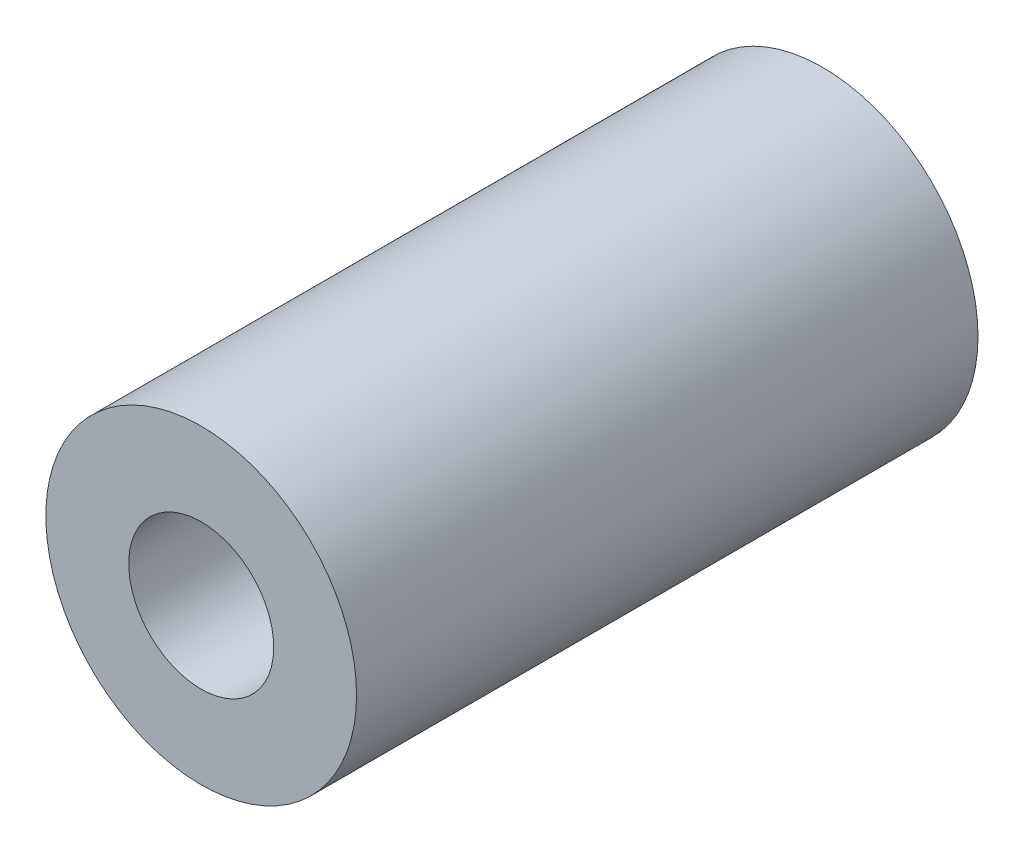
from build123d import *

# Parameters (mm, degrees)
SKETCH1_R           = 3.75
SKETCH1_R_2         = 1.75
BOSS_EXTRUDE1_DEPTH = 15


with BuildPart() as part:
    # Sketch1 → Boss-Extrude1 (new body)
    with BuildSketch(Plane.XY):
        Circle(SKETCH1_R)
        Circle(SKETCH1_R_2, mode=Mode.SUBTRACT)
    extrude(amount=BOSS_EXTRUDE1_DEPTH)


solid = part.part
